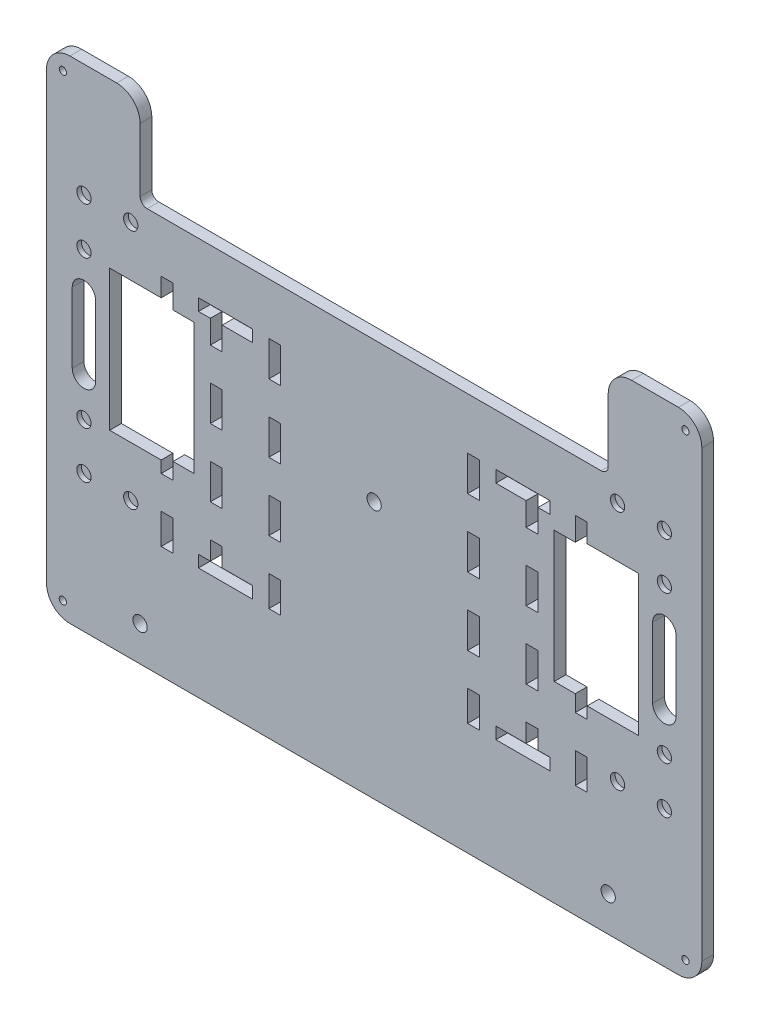
from build123d import *

# Parameters (mm, degrees)
BOSS_EXTRU_1_DEPTH      = 5
ESQUISSE2_W             = 5.07
ESQUISSE2_H             = 13
ESQUISSE2_H_2           = 15
ENL_V_MAT_EXTRU_1_DEPTH = 10
ESQUISSE3_R             = 3.05
ENL_V_MAT_EXTRU_2_DEPTH = 2
ENL_V_MAT_EXTRU_3_DEPTH = 176.071414
ESQUISSE5_R             = 3.05
ESQUISSE5_R_2           = 1.55
ENL_V_MAT_EXTRU_4_DEPTH = 176.071414


with BuildPart() as part:
    # Esquisse1 → Boss.-Extru.1 (new body)
    with BuildSketch(Plane.XY):
        with BuildLine():
            Line((130, -105), (-130, -105))
            ThreePointArc((-130, -105), (-137.071067812, -102.071067812), (-140, -95))
            Line((-140, -95), (-140, 105))
            Line((-140, 105), (140, 105))
            Line((140, 105), (140, -95))
            ThreePointArc((140, -95), (137.071067812, -102.071067812), (130, -105))
        make_face()
    extrude(amount=BOSS_EXTRU_1_DEPTH)

    # Esquisse2 → Enlèv. mat.-Extru.1 (cut)
    with BuildSketch(Plane.XY.offset(5)):
        Polygon((-91, 35), (-113, 35), (-113, -25), (-91, -25), (-91, -30), (-85.93, -30), (-85.93, -23), (-76.93, -23), (-76.93, 33), (-85.93, 33), (-85.93, 43), (-91, 43), align=None)
        with Locations((-88.465, -50.5)):
            Rectangle(ESQUISSE2_W, ESQUISSE2_H)
        with Locations((-67.465, 6.5)):
            Rectangle(ESQUISSE2_W, ESQUISSE2_H_2)
        Polygon((-70, 28), (-64.93, 28), (-64.93, 37.93), (-52, 37.93), (-52, 43), (-75.07, 43), (-75.07, 37.93), (-70, 37.93), align=None)
        Polygon((-52, -57), (-52, -51.93), (-64.93, -51.93), (-64.93, -44), (-70, -44), (-70, -51.93), (-75.07, -51.93), (-75.07, -57), align=None)
        with Locations((-67.465, -22.5)):
            Rectangle(ESQUISSE2_W, ESQUISSE2_H_2)
        with Locations((-42.465, 6.5)):
            Rectangle(ESQUISSE2_W, ESQUISSE2_H_2)
        with Locations((-42.465, 35.5)):
            Rectangle(ESQUISSE2_W, ESQUISSE2_H_2)
        with Locations((-42.465, -50.5)):
            Rectangle(ESQUISSE2_W, ESQUISSE2_H)
        with Locations((-42.465, -22.5)):
            Rectangle(ESQUISSE2_W, ESQUISSE2_H_2)
        Polygon((52, -51.93), (52, -57), (75.07, -57), (75.07, -51.93), (70, -51.93), (70, -44), (64.93, -44), (64.93, -51.93), align=None)
        Polygon((52, 43), (52, 37.93), (64.93, 37.93), (64.93, 28), (70, 28), (70, 37.93), (75.07, 37.93), (75.07, 43), align=None)
        with Locations((42.465, -50.5)):
            Rectangle(ESQUISSE2_W, ESQUISSE2_H)
        with Locations((42.465, -22.5)):
            Rectangle(ESQUISSE2_W, ESQUISSE2_H_2)
        with Locations((42.465, 6.5)):
            Rectangle(ESQUISSE2_W, ESQUISSE2_H_2)
        with Locations((42.465, 35.5)):
            Rectangle(ESQUISSE2_W, ESQUISSE2_H_2)
        with Locations((67.465, -22.5)):
            Rectangle(ESQUISSE2_W, ESQUISSE2_H_2)
        with Locations((67.465, 6.5)):
            Rectangle(ESQUISSE2_W, ESQUISSE2_H_2)
        with Locations((88.465, -50.5)):
            Rectangle(ESQUISSE2_W, ESQUISSE2_H)
        Polygon((85.93, -30), (91, -30), (91, -25), (113, -25), (113, 35), (91, 35), (91, 43), (85.93, 43), (85.93, 33), (76.93, 33), (76.93, -23), (85.93, -23), align=None)
    extrude(amount=-ENL_V_MAT_EXTRU_1_DEPTH, mode=Mode.SUBTRACT)

    # Esquisse3 → Enlèv. mat.-Extru.2 (cut)
    with BuildSketch(Plane.XY.offset(5)):
        with Locations((-124, -26.5)):
            Circle(ESQUISSE3_R)
        with Locations((-124, 36.5)):
            Circle(ESQUISSE3_R)
        with Locations(Location((124, 36.5, 0), (0, 0, 180))):
            Circle(ESQUISSE3_R)
        with Locations(Location((124, -26.5, 0), (0, 0, 180))):
            Circle(ESQUISSE3_R)
        with Locations((-124, 56.5)):
            Circle(ESQUISSE3_R)
        with Locations((-104, 56.5)):
            Circle(ESQUISSE3_R)
        with Locations(Location((-104, -46.5, 0), (0, 0, 180))):
            Circle(ESQUISSE3_R)
        with Locations(Location((-124, -46.5, 0), (0, 0, 180))):
            Circle(ESQUISSE3_R)
        with Locations((124, -46.5)):
            Circle(ESQUISSE3_R)
        with Locations((104, -46.5)):
            Circle(ESQUISSE3_R)
        with Locations(Location((104, 56.5, 0), (0, 0, 180))):
            Circle(ESQUISSE3_R)
        with Locations(Location((124, 56.5, 0), (0, 0, 180))):
            Circle(ESQUISSE3_R)
    extrude(amount=-ENL_V_MAT_EXTRU_2_DEPTH, mode=Mode.SUBTRACT)

    # Esquisse4 → Enlèv. mat.-Extru.3 (cut, through all)
    with BuildSketch(Plane.XY.offset(5)):
        with BuildLine():
            Line((-119, 20), (-119, -10))
            ThreePointArc((-119, -10), (-124, -15), (-129, -10))
            Line((-129, -10), (-129, 20))
            ThreePointArc((-129, 20), (-124, 25), (-119, 20))
        make_face()
        with BuildLine():
            Line((119, 20), (119, -10))
            ThreePointArc((119, -10), (124, -15), (129, -10))
            Line((129, -10), (129, 20))
            ThreePointArc((129, 20), (124, 25), (119, 20))
        make_face()
        with BuildLine():
            Line((-110, 105), (110, 105))
            ThreePointArc((110, 105), (102.928932188, 102.071067812), (100, 95))
            Line((100, 95), (100, 68))
            ThreePointArc((100, 68), (99.121320344, 65.878679656), (97, 65))
            Line((97, 65), (-97, 65))
            ThreePointArc((-97, 65), (-99.121320344, 65.878679656), (-100, 68))
            Line((-100, 68), (-100, 95))
            ThreePointArc((-100, 95), (-102.928932188, 102.071067812), (-110, 105))
        make_face()
        with BuildLine():
            Line((140, 105), (130, 105))
            ThreePointArc((130, 105), (137.071067812, 102.071067812), (140, 95))
            Line((140, 95), (140, 105))
        make_face()
        with BuildLine():
            Line((-140, 95), (-140, 105))
            Line((-140, 105), (-130, 105))
            ThreePointArc((-130, 105), (-137.071067812, 102.071067812), (-140, 95))
        make_face()
    extrude(amount=-ENL_V_MAT_EXTRU_3_DEPTH, mode=Mode.SUBTRACT)

    # Esquisse5 → Enlèv. mat.-Extru.4 (cut, through all)
    with BuildSketch(Plane.XY.offset(5)):
        with Locations((0, 5)):
            Circle(ESQUISSE5_R)
        with Locations((-133, 98)):
            Circle(ESQUISSE5_R_2)
        with Locations((-100, -90)):
            Circle(ESQUISSE5_R)
        with Locations((-133, -98)):
            Circle(ESQUISSE5_R_2)
        with Locations((133, -98)):
            Circle(ESQUISSE5_R_2)
        with Locations((100, -90)):
            Circle(ESQUISSE5_R)
        with Locations((133, 98)):
            Circle(ESQUISSE5_R_2)
    extrude(amount=-ENL_V_MAT_EXTRU_4_DEPTH, mode=Mode.SUBTRACT)


solid = part.part
